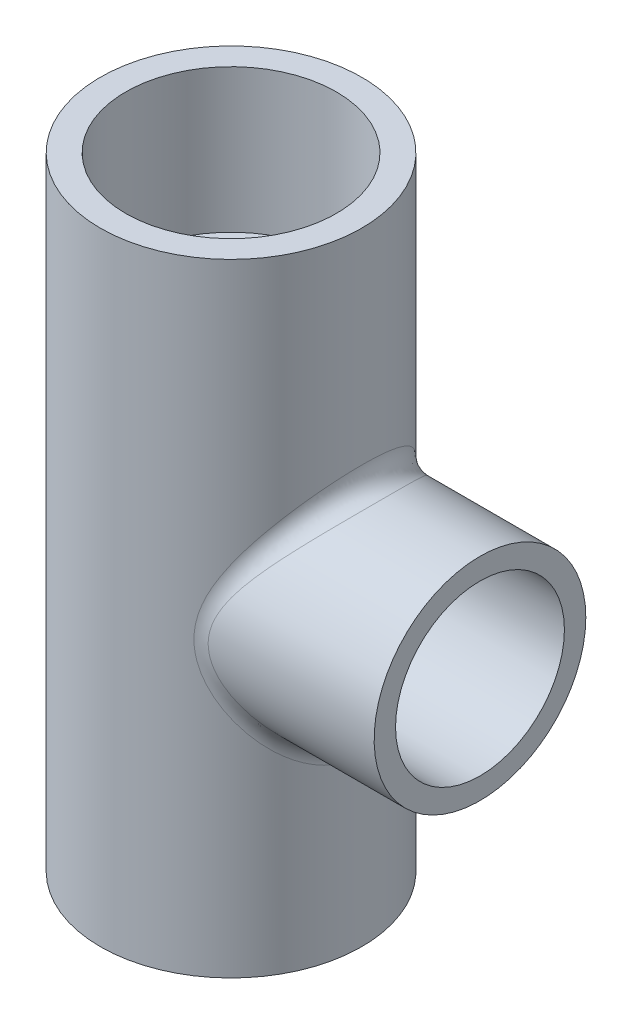
from build123d import *

# Parameters (mm, degrees)
SKETCH1_R               = 16.6751
BOSS_EXTRUDE1_DEPTH     = 79.375
CUT_EXTRUDE1_DEPTH      = 83.804037009
CUT_EXTRUDE1_DEPTH_BACK = 83.804037009
SKETCH1_4_R             = 10.4648
SKETCH1_5_R             = 13.4366
SKETCH1_5_R_2           = 10.4648
CUT_EXTRUDE2_DEPTH      = 18.288
CUT_EXTRUDE3_START      = -18.288
SKETCH2_R               = 13.4366
SKETCH2_R_2             = 10.4648
CUT_EXTRUDE3_DEPTH      = 18.288
SKETCH3_R               = 13.5001
BOSS_EXTRUDE2_DEPTH     = 31.75
SKETCH3_7_R             = 7.8994
CUT_EXTRUDE5_DEPTH      = 33.3502
CUT_EXTRUDE6_START      = -17.526
SKETCH4_R               = 10.7696
SKETCH4_R_2             = 7.8994
CUT_EXTRUDE6_DEPTH      = 17.526
FILLET1_R               = 2.54


with BuildPart() as part:
    # Sketch1 → Boss-Extrude1 (new body)
    with BuildSketch(Plane(origin=(0, 0, 0), x_dir=(1, 0, 0), z_dir=(0, 1, 0))):
        with Locations(Location((0, 0, 0), (0, 0, 90))):
            Circle(SKETCH1_R)
    extrude(amount=BOSS_EXTRUDE1_DEPTH)

    # Sketch1<4> → Cut-Extrude1 (cut, two sides: drawn at the far end of the back side and taken through both)
    with BuildSketch(Plane(origin=(0, 0, 0), x_dir=(1, 0, 0), z_dir=(0, 1, 0)).offset(-CUT_EXTRUDE1_DEPTH_BACK)):
        with Locations(Location((0, 0, 0), (0, 0, 90))):
            Circle(SKETCH1_4_R)
    extrude(amount=CUT_EXTRUDE1_DEPTH + CUT_EXTRUDE1_DEPTH_BACK, mode=Mode.SUBTRACT)

    # Sketch1<5> → Cut-Extrude2 (cut)
    with BuildSketch(Plane(origin=(0, 0, 0), x_dir=(1, 0, 0), z_dir=(0, 1, 0))):
        with Locations(Location((0, 0, 0), (0, 0, 270))):
            Circle(SKETCH1_5_R)
        with Locations(Location((0, 0, 0), (0, 0, 90))):
            Circle(SKETCH1_5_R_2, mode=Mode.SUBTRACT)
    extrude(amount=CUT_EXTRUDE2_DEPTH, mode=Mode.SUBTRACT)

    # Sketch2 → Cut-Extrude3 (cut)
    with BuildSketch(Plane(origin=(0, 79.375, 0), x_dir=(1, 0, 0), z_dir=(0, 1, 0)).offset(CUT_EXTRUDE3_START)):
        with Locations(Location((0, 0, 0), (0, 0, 270))):
            Circle(SKETCH2_R)
        with Locations(Location((0, 0, 0), (0, 0, 90))):
            Circle(SKETCH2_R_2, mode=Mode.SUBTRACT)
    extrude(amount=CUT_EXTRUDE3_DEPTH, mode=Mode.SUBTRACT)

    # Sketch3 → Boss-Extrude2 (add)
    with BuildSketch(Plane(origin=(0, 0, 0), x_dir=(0, 0, -1), z_dir=(1, 0, 0))):
        with Locations(Location((0, 37.168433559, 0), (0, 0, 180))):
            Circle(SKETCH3_R)
    extrude(amount=BOSS_EXTRUDE2_DEPTH)

    # Sketch3<7> → Cut-Extrude5 (cut)
    with BuildSketch(Plane(origin=(0, 0, 0), x_dir=(0, 0, -1), z_dir=(1, 0, 0))):
        with Locations((0, 37.168433559)):
            Circle(SKETCH3_7_R)
    extrude(amount=CUT_EXTRUDE5_DEPTH, mode=Mode.SUBTRACT)

    # Sketch4 → Cut-Extrude6 (cut)
    with BuildSketch(Plane(origin=(31.75, 0, 0), x_dir=(0, 0, -1), z_dir=(1, 0, 0)).offset(CUT_EXTRUDE6_START)):
        with Locations((0, 37.168433559)):
            Circle(SKETCH4_R)
        with Locations((0, 37.168433559)):
            Circle(SKETCH4_R_2, mode=Mode.SUBTRACT)
    extrude(amount=CUT_EXTRUDE6_DEPTH, mode=Mode.SUBTRACT)

    # Fillet1
    fillet1_edges = [part.edges().sort_by_distance(p)[0] for p in [
        (9.788067225, 37.168433559, -13.5001),
    ]]
    fillet(fillet1_edges, radius=FILLET1_R)


solid = part.part
